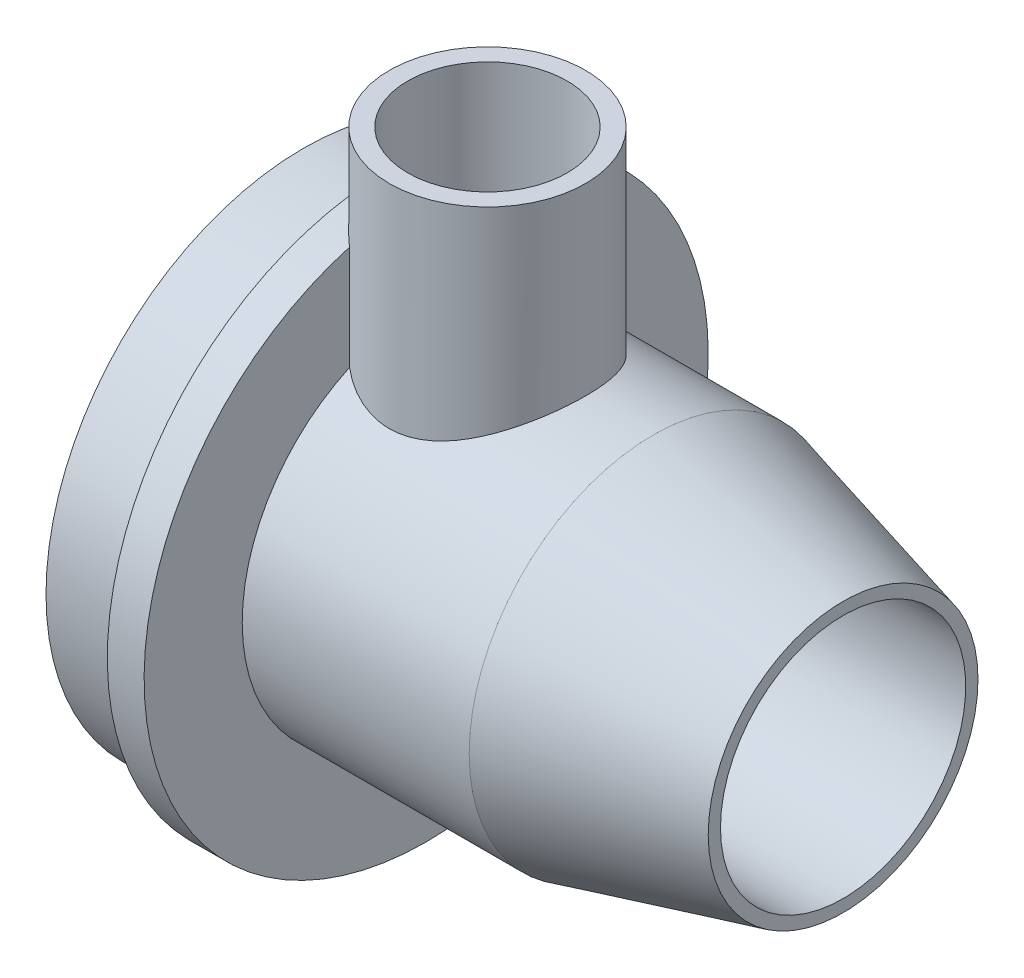
from build123d import *

# Parameters (mm, degrees)
BOSS_EXTRU_1_REACH           = 74.622
ESQUISSE2_R                  = 8
ENL_V_MAT_EXTRU_1_REACH      = 74.622
ENL_V_MAT_EXTRU_1_END_RADIUS = 10
ESQUISSE4_R                  = 6.5


with BuildPart() as part:
    # Esquisse1 → Révolution1 (revolve)
    with BuildSketch(Plane.XY, mode=Mode.PRIVATE) as r_volution1_sk:
        Polygon((44, 10), (44, 11), (28.508066615, 15), (10, 15), (10, 23), (7, 23), (7, 21), (0, 21), (0, 10), align=None)
    revolve(r_volution1_sk.sketch.rotate(Axis((0, 0, 0), (1, 0, 0)), 90), axis=Axis((0, 0, 0), (1, 0, 0)))

    # Esquisse2 → Boss.-Extru.1 (add, up to next)
    with BuildSketch(Plane(origin=(0, 30, 0), x_dir=(1, 0, 0), z_dir=(0, 1, 0)), mode=Mode.PRIVATE) as boss_extru_1_sk1:
        with Locations(Location((15, 0, 0), (0, 0, 270))):
            Circle(ESQUISSE2_R)
    boss_extru_1_tool1 = extrude(boss_extru_1_sk1.sketch, amount=-BOSS_EXTRU_1_REACH, mode=Mode.PRIVATE) - part.part
    add(boss_extru_1_tool1.solids().sort_by_distance((15, 30, 0))[0])

    # Enlèv. mat.-Extru.1: up to this cylinder (the profile starts outside it)
    enl_v_mat_extru_1_end = Plane(origin=(15, 0, 0), z_dir=(-1, 0, 0)) * Cylinder(ENL_V_MAT_EXTRU_1_END_RADIUS, 170.244, mode=Mode.PRIVATE)
    # Esquisse4 → Enlèv. mat.-Extru.1 (cut, up to the surface)
    with BuildSketch(Plane(origin=(0, 30, 0), x_dir=(1, 0, 0), z_dir=(0, 1, 0)), mode=Mode.PRIVATE) as enl_v_mat_extru_1_sk1:
        with Locations(Location((15, 0, 0), (0, 0, 270))):
            Circle(ESQUISSE4_R)
    enl_v_mat_extru_1_tool1 = extrude(enl_v_mat_extru_1_sk1.sketch, amount=-ENL_V_MAT_EXTRU_1_REACH, mode=Mode.PRIVATE) - enl_v_mat_extru_1_end
    add(enl_v_mat_extru_1_tool1.solids().sort_by_distance((15, 30, 0))[0], mode=Mode.SUBTRACT)


solid = part.part
